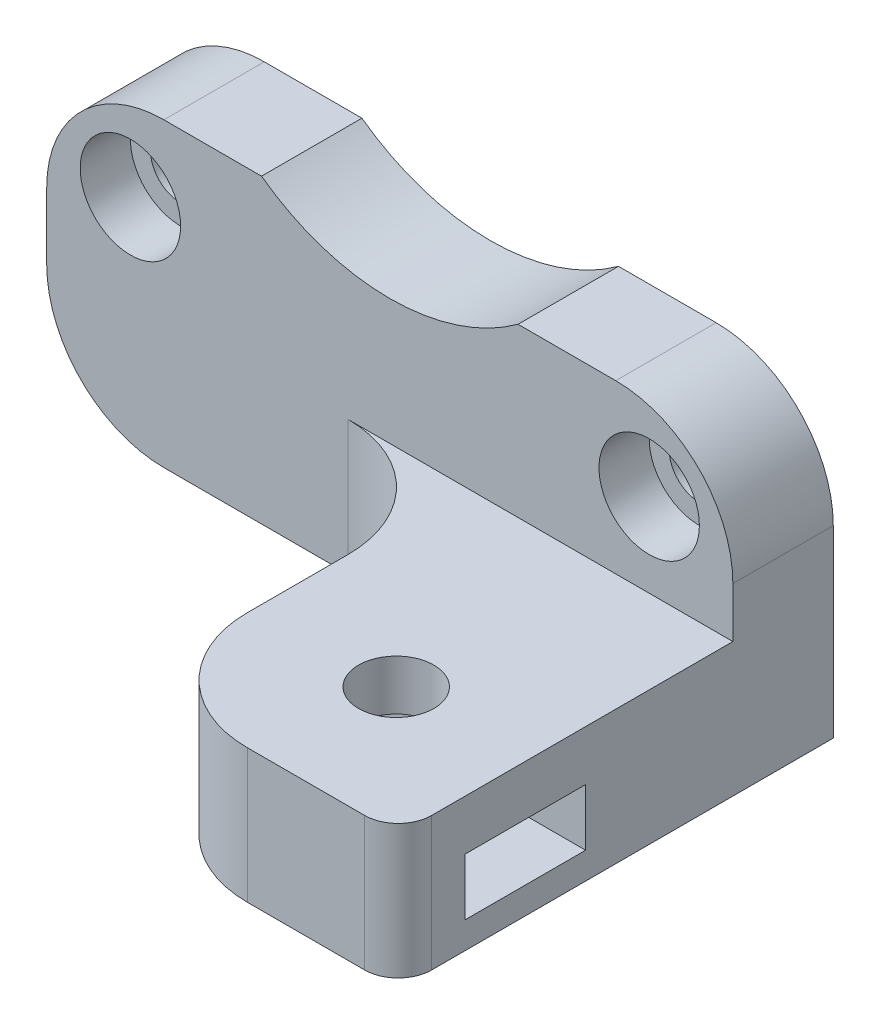
from build123d import *

# Parameters (mm, degrees)
BOSS_EXTRUDE2_DEPTH  = 41
SKETCH3_R            = 1.8
SKETCH3_R_2          = 13
CUT_EXTRUDE1_DEPTH   = 47.701177715
M4_CLEARANCE_HOLE1_D = 4.5
SKETCH6_R            = 3
CUT_EXTRUDE2_DEPTH   = 3
CUT_EXTRUDE3_START   = -6.4
SKETCH7_R            = 2.25
CUT_EXTRUDE3_DEPTH   = 3.4
FILLET3_R            = 2
SKETCH9_W            = 25
SKETCH9_H            = 20
CUT_EXTRUDE5_DEPTH   = 47.701177715
FILLET5_R            = 7


with BuildPart() as part:
    # Sketch2 → Boss-Extrude2 (new body)
    with BuildSketch(Plane(origin=(0, 0, 0), x_dir=(0, 0, -1), z_dir=(1, 0, 0))):
        Polygon((0, 0), (0, 10), (6, 10), (6, -8), (-20, -8), (-20, 0), align=None)
    extrude(amount=BOSS_EXTRUDE2_DEPTH)

    # Sketch3 → Cut-Extrude1 (cut, through all)
    with BuildSketch(Plane.XY):
        with Locations((5, 5)):
            Circle(SKETCH3_R)
        with Locations((36, 5)):
            Circle(SKETCH3_R)
        with Locations((20.5, 20.5)):
            Circle(SKETCH3_R_2)
    extrude(amount=-CUT_EXTRUDE1_DEPTH, mode=Mode.SUBTRACT)

    # M4 Clearance Hole1 (through all)
    with Locations(Plane(origin=(33.28379107, 0, 12.4), x_dir=(0, 0, 1), z_dir=(0, 1, 0))):
        with Locations((0, 0)):
            Hole(M4_CLEARANCE_HOLE1_D / 2)

    # Sketch6 → Cut-Extrude2 (cut)
    with BuildSketch(Plane.XY):
        with Locations((5, 5)):
            Circle(SKETCH6_R)
        with Locations((36, 5)):
            Circle(SKETCH6_R)
    extrude(amount=-CUT_EXTRUDE2_DEPTH, mode=Mode.SUBTRACT)

    # Sketch7 → Cut-Extrude3 (cut)
    with BuildSketch(Plane(origin=(0, 0, 0), x_dir=(1, 0, 0), z_dir=(0, 1, 0)).offset(CUT_EXTRUDE3_START)):
        with Locations(Location((33.28379107, -12.4, 0), (0, 0, 270))):
            Circle(SKETCH7_R)
        Polygon((26.726869132, -12.4), (28.805330101, -16), (32.962252039, -16), (35.040713008, -12.4), (32.962252039, -8.8), (28.805330101, -8.8), align=None)
        with BuildLine():
            Line((33.772715521, -14.596236071), (32.962252039, -16))
            Line((32.962252039, -16), (41, -16))
            Line((41, -16), (41, -8.8))
            Line((41, -8.8), (32.962252039, -8.8))
            Line((32.962252039, -8.8), (33.772715521, -10.203763929))
            ThreePointArc((33.772715521, -10.203763929), (35.039151434, -10.992445386), (35.53379107, -12.4))
            ThreePointArc((35.53379107, -12.4), (35.039151434, -13.807554614), (33.772715521, -14.596236071))
        make_face()
    extrude(amount=CUT_EXTRUDE3_DEPTH, mode=Mode.SUBTRACT)

    # Fillet3
    fillet3_edges = [part.edges().sort_by_distance(p)[0] for p in [
        (41, -4, 20),
    ]]
    fillet(fillet3_edges, radius=FILLET3_R)

    # Sketch9 → Cut-Extrude5 (cut, through all)
    with BuildSketch(Plane(origin=(0, 0, 0), x_dir=(1, 0, 0), z_dir=(0, 1, 0))):
        with Locations((12.5, -10)):
            Rectangle(SKETCH9_W, SKETCH9_H)
    extrude(amount=-CUT_EXTRUDE5_DEPTH, mode=Mode.SUBTRACT)

    # Fillet5
    fillet5_edges = [part.edges().sort_by_distance(p)[0] for p in [
        (41, 10, -3),
        (0, -8, -3),
        (0, 10, -3),
        (25, -4, 0),
        (25, -4, 20),
    ]]
    fillet(fillet5_edges, radius=FILLET5_R)


solid = part.part
